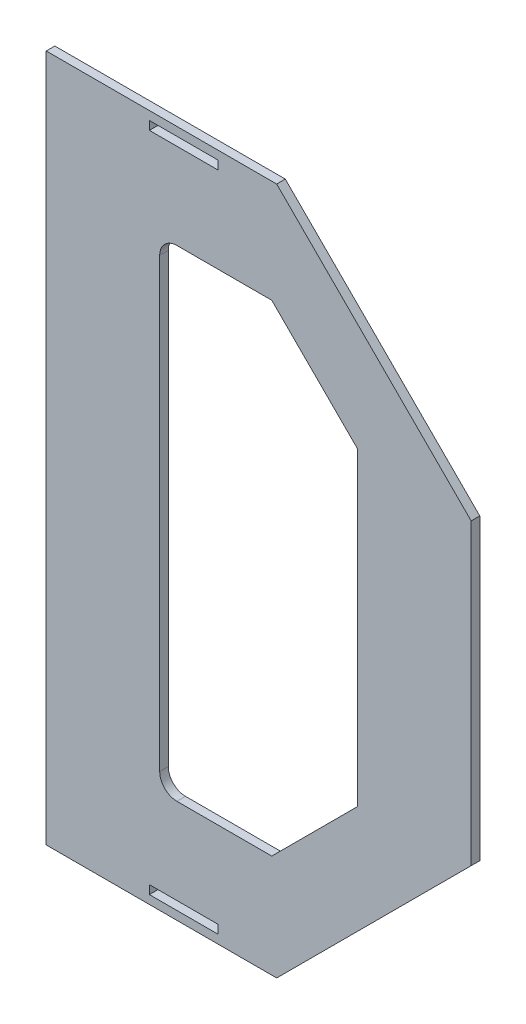
from build123d import *

# Parameters (mm, degrees)
SKETCH1_W         = 25.4
SKETCH1_H         = 3.175
PLATE_DEPTH       = 1.5875
CENTER_HOLE_DEPTH = 150.328941672


with BuildPart() as part:
    # Sketch1 → Plate (new, symmetric)
    with BuildSketch(Plane.XY):
        Polygon((-78.486, 127), (6.643951031, 127), (78.486, 55.157951031), (78.486, -55.157951031), (6.643951031, -127), (-78.486, -127), align=None)
        with Locations((-27.686, 122.2375)):
            Rectangle(SKETCH1_W, SKETCH1_H, mode=Mode.SUBTRACT)
        with Locations((-27.686, -122.2375)):
            Rectangle(SKETCH1_W, SKETCH1_H, mode=Mode.SUBTRACT)
    extrude(amount=PLATE_DEPTH, both=True)

    # Sketch4 → Center Hole (cut, through all)
    with BuildSketch(Plane.XY.offset(1.5875)):
        with BuildLine():
            Line((4.826, 88.9), (36.576, 57.15))
            Line((36.576, 57.15), (36.576, -57.15))
            Line((36.576, -57.15), (4.826, -88.9))
            Line((4.826, -88.9), (-30.226, -88.9))
            ThreePointArc((-30.226, -88.9), (-34.716128061, -87.040128061), (-36.576, -82.55))
            Line((-36.576, -82.55), (-36.576, 82.55))
            ThreePointArc((-36.576, 82.55), (-34.716128061, 87.040128061), (-30.226, 88.9))
            Line((-30.226, 88.9), (4.826, 88.9))
        make_face()
    extrude(amount=-CENTER_HOLE_DEPTH, mode=Mode.SUBTRACT)


solid = part.part
